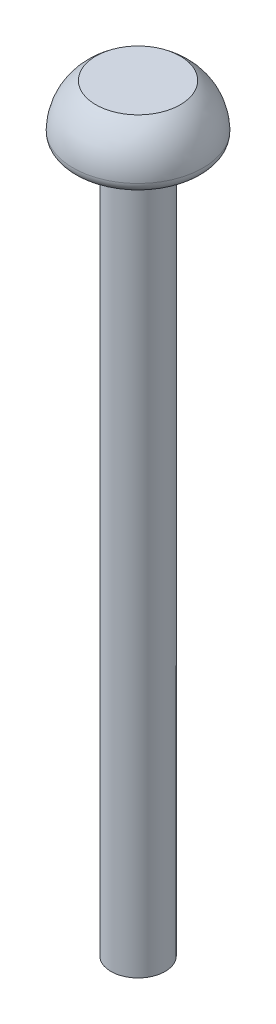
from build123d import *


with BuildPart() as part:
    # Esquisse1 → Révolution1 (revolve)
    with BuildSketch(Plane.XY, mode=Mode.PRIVATE) as r_volution1_sk:
        Polygon((8, 83.602856599), (8, 33.602856599), (25, 33.602856599), (25, 683.602856599), (0, 683.602856599), (0, 83.602856599), align=None)
        with BuildLine():
            Line((0, 693.602856599), (60, 693.602856599))
            ThreePointArc((60, 693.602856599), (54.2599688, 716.114995661), (38.965555337, 733.602856599))
            Line((38.965555337, 733.602856599), (0, 733.602856599))
            Line((0, 733.602856599), (0, 693.602856599))
        make_face()
        with BuildLine():
            Line((25, 683.602856599), (50, 683.602856599))
            ThreePointArc((50, 683.602856599), (57.071067812, 686.531788787), (60, 693.602856599))
            Line((60, 693.602856599), (0, 693.602856599))
            Line((0, 693.602856599), (0, 683.602856599))
            Line((0, 683.602856599), (25, 683.602856599))
        make_face()
    revolve(r_volution1_sk.sketch.rotate(Axis((0, -51.478862279, 0), (0, 1, 0)), 90), axis=Axis((0, -51.478862279, 0), (0, 1, 0)))


solid = part.part
